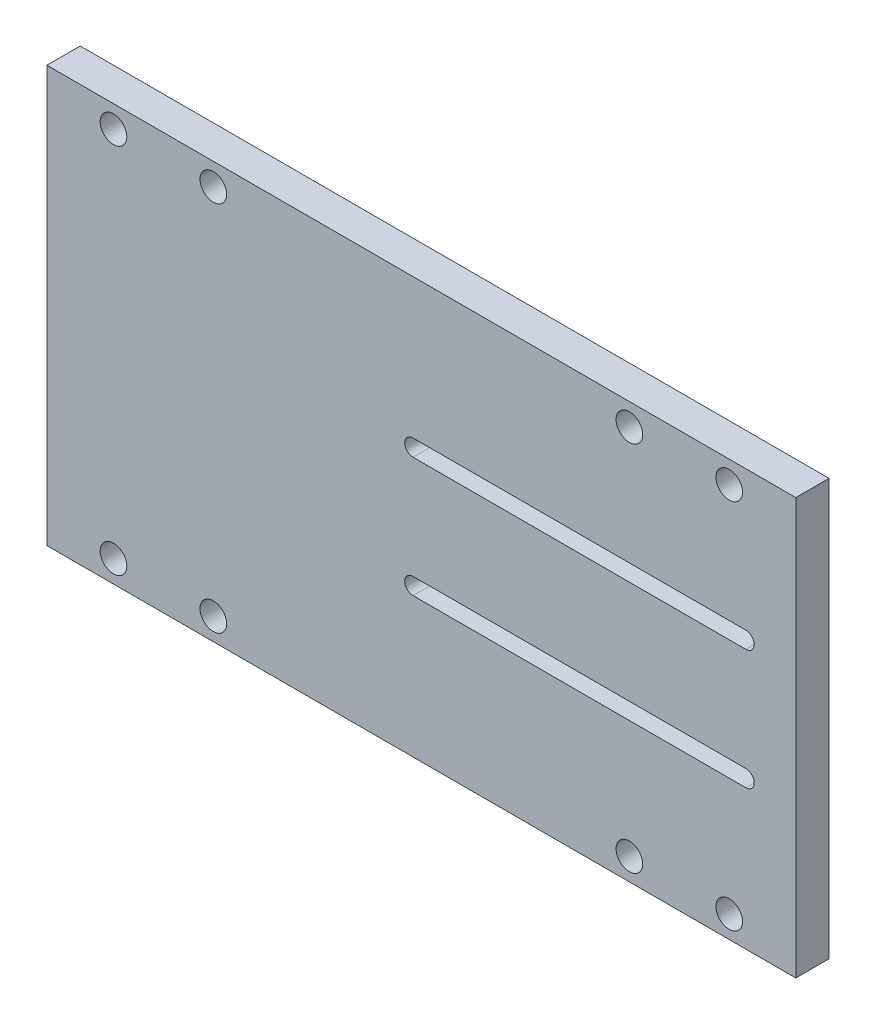
from build123d import *

# Parameters (mm, degrees)
SKETCH1_W           = 114.3
SKETCH1_H           = 63.5
BOSS_EXTRUDE3_DEPTH = 5.08
SKETCH2_R           = 2.032
CUT_EXTRUDE4_DEPTH  = 131.853148223
CUT_EXTRUDE5_DEPTH  = 131.853148223


with BuildPart() as part:
    # Sketch1 → Boss-Extrude3 (new body)
    with BuildSketch(Plane.XY):
        with Locations((57.15, 31.75)):
            Rectangle(SKETCH1_W, SKETCH1_H)
    extrude(amount=BOSS_EXTRUDE3_DEPTH)

    # Sketch2 → Cut-Extrude4 (cut, through all)
    with BuildSketch(Plane.XY):
        with Locations((88.9, 60.1218)):
            Circle(SKETCH2_R)
        with Locations(Location((88.9, 3.3782, 0), (0, 0, 180))):
            Circle(SKETCH2_R)
        with Locations((25.4, 3.3782)):
            Circle(SKETCH2_R)
        with Locations(Location((25.4, 60.1218, 0), (0, 0, 180))):
            Circle(SKETCH2_R)
        with Locations((10.16, 3.3782)):
            Circle(SKETCH2_R)
        with Locations(Location((10.16, 60.1218, 0), (0, 0, 180))):
            Circle(SKETCH2_R)
        with Locations(Location((104.14, 3.3782, 0), (0, 0, 180))):
            Circle(SKETCH2_R)
        with Locations((104.14, 60.1218)):
            Circle(SKETCH2_R)
    extrude(amount=CUT_EXTRUDE4_DEPTH, mode=Mode.SUBTRACT)

    # Sketch3 → Cut-Extrude5 (cut, through all)
    with BuildSketch(Plane(origin=(0, 0, 0), x_dir=(-1, 0, 0), z_dir=(0, 0, -1))):
        with BuildLine():
            Line((-106.68, 42.164), (-55.88, 42.164))
            ThreePointArc((-55.88, 42.164), (-54.61, 40.894), (-55.88, 39.624))
            Line((-55.88, 39.624), (-106.68, 39.624))
            ThreePointArc((-106.68, 39.624), (-107.95, 40.894), (-106.68, 42.164))
        make_face()
        with BuildLine():
            Line((-106.68, 23.876), (-55.88, 23.876))
            ThreePointArc((-55.88, 23.876), (-54.61, 22.606), (-55.88, 21.336))
            Line((-55.88, 21.336), (-106.68, 21.336))
            ThreePointArc((-106.68, 21.336), (-107.95, 22.606), (-106.68, 23.876))
        make_face()
    extrude(amount=-CUT_EXTRUDE5_DEPTH, mode=Mode.SUBTRACT)


solid = part.part
